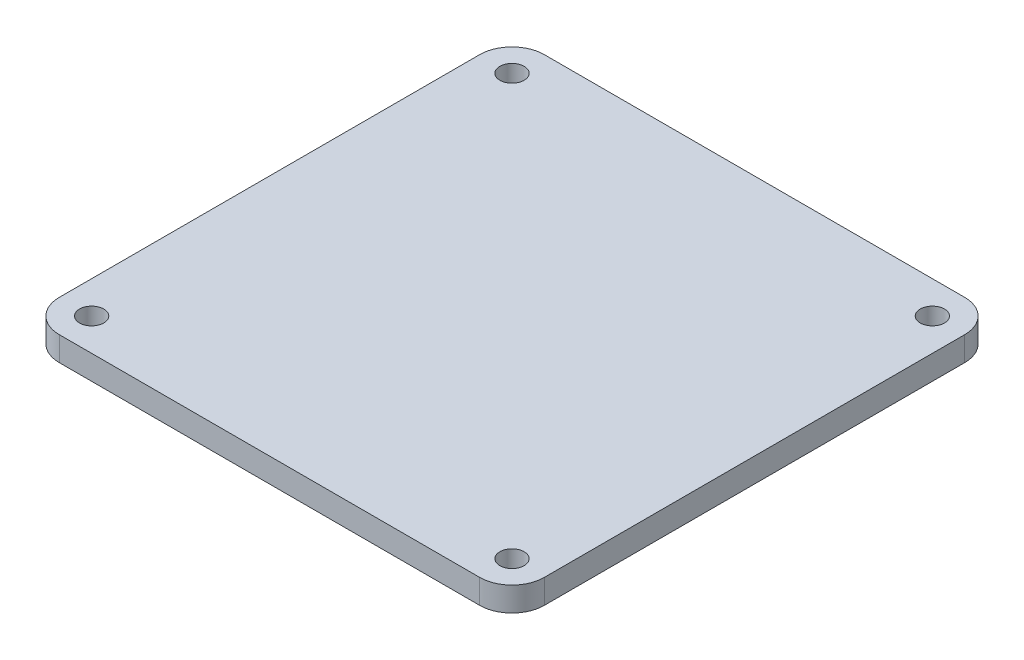
from build123d import *

# Parameters (mm, degrees)
SKETCH_1_R      = 1.5
EXTRUDE_1_DEPTH = 3


with BuildPart() as part:
    # 草图1 → 凸台-拉伸1 (new body)
    with BuildSketch(Plane(origin=(0, 0, 0), x_dir=(1, 0, 0), z_dir=(0, 1, 0))):
        with BuildLine():
            Line((-26, -30), (26, -30))
            ThreePointArc((26, -30), (28.828427125, -28.828427125), (30, -26))
            Line((30, -26), (30, 26))
            ThreePointArc((30, 26), (28.828427125, 28.828427125), (26, 30))
            Line((26, 30), (-26, 30))
            ThreePointArc((-26, 30), (-28.828427125, 28.828427125), (-30, 26))
            Line((-30, 26), (-30, -26))
            ThreePointArc((-30, -26), (-28.828427125, -28.828427125), (-26, -30))
        make_face()
        with Locations(Location((-26, 26, 0), (0, 0, 270))):
            Circle(SKETCH_1_R, mode=Mode.SUBTRACT)
        with Locations(Location((26, 26, 0), (0, 0, 270))):
            Circle(SKETCH_1_R, mode=Mode.SUBTRACT)
        with Locations(Location((26, -26, 0), (0, 0, 270))):
            Circle(SKETCH_1_R, mode=Mode.SUBTRACT)
        with Locations(Location((-26, -26, 0), (0, 0, 270))):
            Circle(SKETCH_1_R, mode=Mode.SUBTRACT)
    extrude(amount=EXTRUDE_1_DEPTH)


solid = part.part
